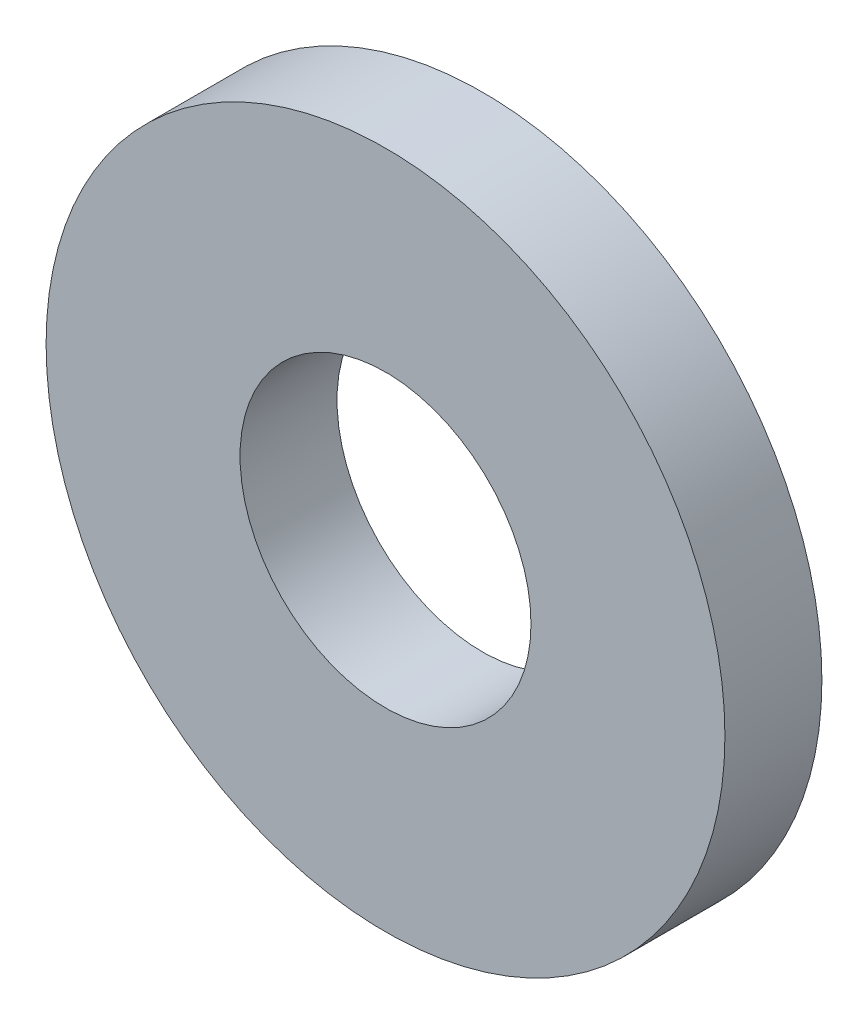
from build123d import *

# Parameters (mm, degrees)
SKETCH_1_R      = 7
SKETCH_1_R_2    = 3
EXTRUDE_1_DEPTH = 1


with BuildPart() as part:
    # 草图1 → 凸台-拉伸1 (new, symmetric)
    with BuildSketch(Plane.XY):
        Circle(SKETCH_1_R)
        Circle(SKETCH_1_R_2, mode=Mode.SUBTRACT)
    extrude(amount=EXTRUDE_1_DEPTH, both=True)


solid = part.part
